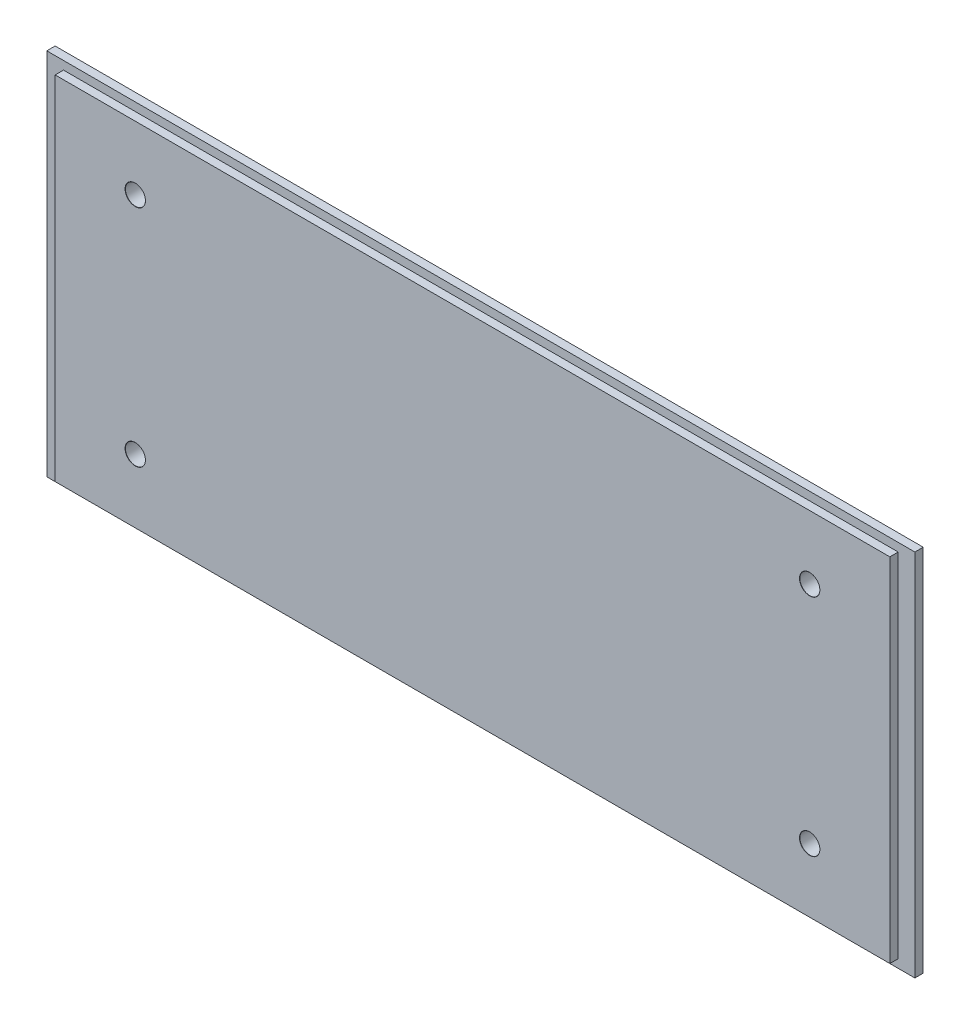
from build123d import *

# Parameters (mm, degrees)
ESBO_O1_W                         = 130
ESBO_O1_H                         = 55.25
RESSALTO_EXTRUS_O1_DEPTH          = 2.5
ESBO_O2_W                         = 130
ESBO_O2_H                         = 55.25
ESBO_O2_W_2                       = 125
ESBO_O2_H_2                       = 52.75
CORTE_EXTRUS_O1_DEPTH             = 1.25
FUROS_GUIA_COM_3_0MM2_D           = 3
FUROS_GUIA_COM_3_0MM2_CSINK_D     = 3.05
FUROS_GUIA_COM_3_0MM2_CSINK_ANGLE = 90


with BuildPart() as part:
    # Esboço1 → Ressalto-extrusão1 (new body)
    with BuildSketch(Plane.XY):
        with Locations((1.708397535, 5.726309707)):
            Rectangle(ESBO_O1_W, ESBO_O1_H)
    extrude(amount=RESSALTO_EXTRUS_O1_DEPTH)

    # Esboço2 → Corte-extrusão1 (cut)
    with BuildSketch(Plane.XY.offset(2.5)):
        with Locations((1.708397535, 5.726309707)):
            Rectangle(ESBO_O2_W, ESBO_O2_H)
        with Locations((1.708397535, 5.726309707)):
            Rectangle(ESBO_O2_W_2, ESBO_O2_H_2, mode=Mode.SUBTRACT)
    extrude(amount=-CORTE_EXTRUS_O1_DEPTH, mode=Mode.SUBTRACT)

    # Furos-guia com Ø3.0mm2 (through all)
    with Locations(Plane.XY.offset(2.5)):
        with Locations((-48.791602465, 22.551309707), (-48.791602465, -11.098690293), (52.208397535, -11.098690293), (52.208397535, 22.551309707)):
            CounterSinkHole(FUROS_GUIA_COM_3_0MM2_D / 2, FUROS_GUIA_COM_3_0MM2_CSINK_D / 2, counter_sink_angle=FUROS_GUIA_COM_3_0MM2_CSINK_ANGLE)


solid = part.part
